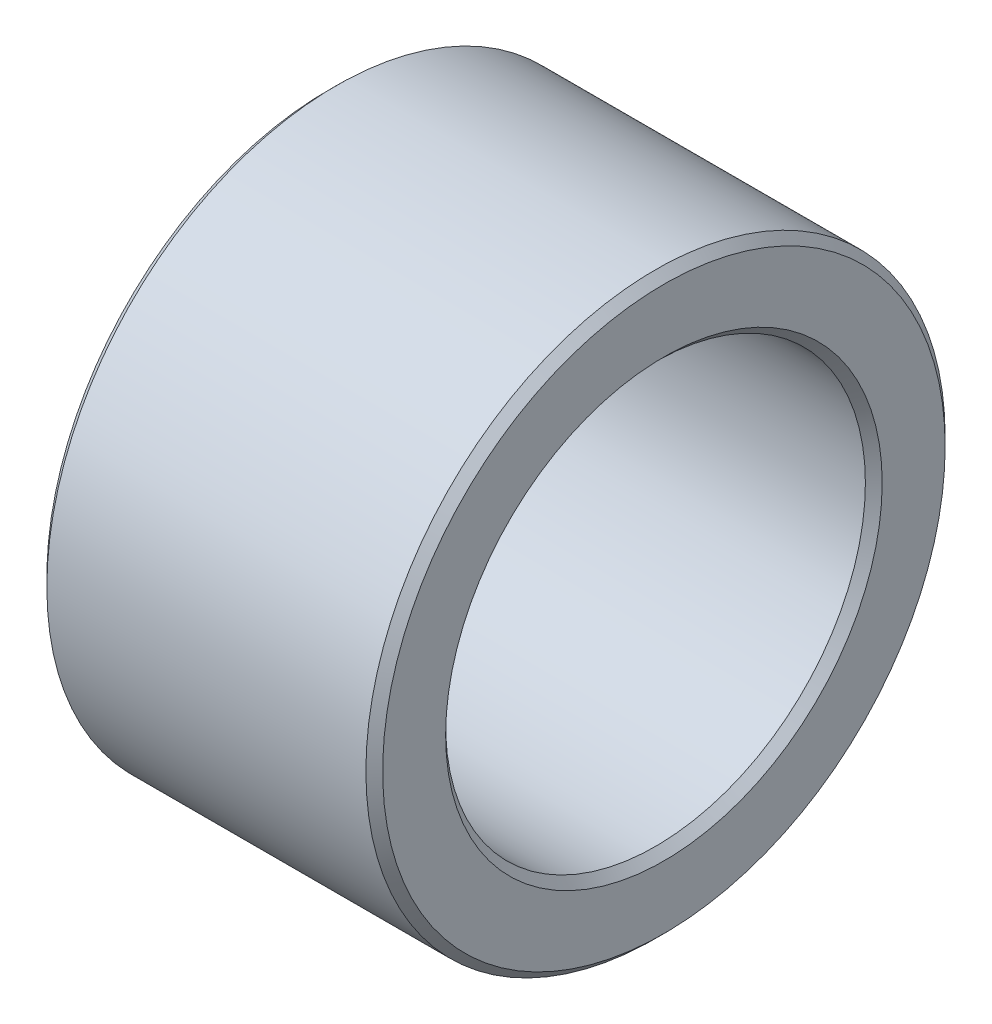
from build123d import *

# Parameters (mm, degrees)
SKETCH_1_R      = 3.45
SKETCH_1_R_2    = 2.5
EXTRUDE_1_DEPTH = 4
CHAMFER_1_SIZE  = 0.1


with BuildPart() as part:
    # 草图1 → 凸台-拉伸1 (new body)
    with BuildSketch(Plane.YZ):
        with Locations(Location((0, 0, 0), (0, 0, 270))):
            Circle(SKETCH_1_R)
        with Locations(Location((0, 0, 0), (0, 0, 270))):
            Circle(SKETCH_1_R_2, mode=Mode.SUBTRACT)
    extrude(amount=EXTRUDE_1_DEPTH)

    # 倒角1
    chamfer_1_edges = [part.edges().sort_by_distance(p)[0] for p in [
        (0, 0, 3.45),
        (4, 0, 3.45),
        (0, 0, 2.5),
        (4, 0, 2.5),
    ]]
    chamfer(chamfer_1_edges, length=CHAMFER_1_SIZE)


solid = part.part
